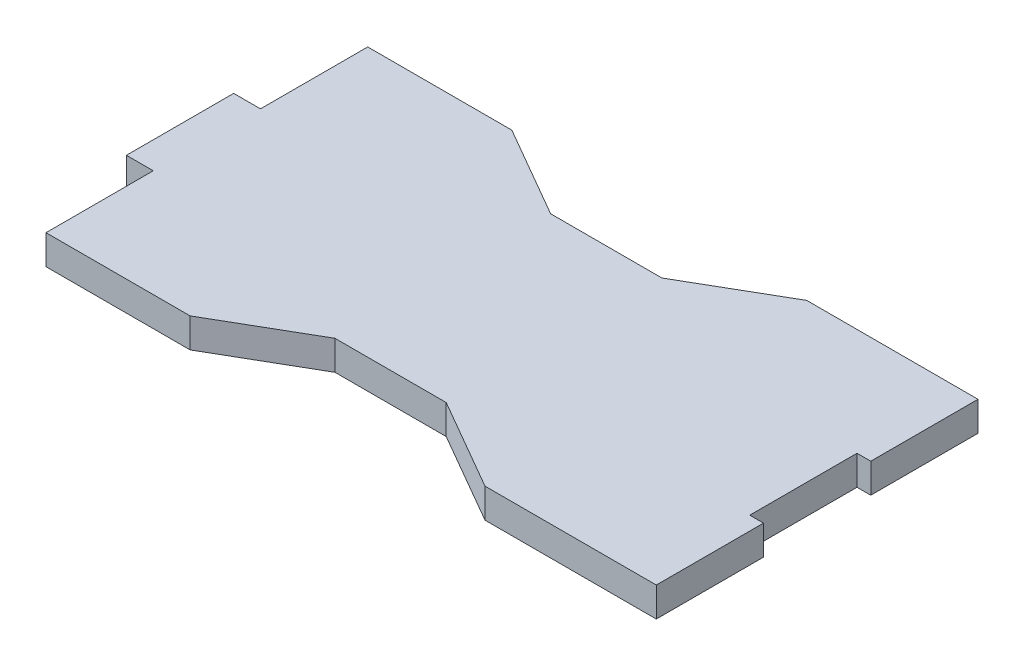
from build123d import *

# Parameters (mm, degrees)
BOSS_EXTRUDE1_DEPTH = 2.2


with BuildPart() as part:
    # Sketch1 → Boss-Extrude1 (new body)
    with BuildSketch(Plane(origin=(0, 0, 0), x_dir=(1, 0, 0), z_dir=(0, 1, 0))):
        Polygon((-90.741972645, 3.865904239), (-90.741972645, 11.865904239), (-103.518191523, 11.865904239), (-110.368333427, 7.910972966), (-118.668049619, 7.910972966), (-125.518191523, 11.865904239), (-136.268191523, 11.865904239), (-136.268191523, 3.865904239), (-138.268191523, 3.865904239), (-138.268191523, -4.134095761), (-136.268191523, -4.134095761), (-136.268191523, -12.134095761), (-125.518191523, -12.134095761), (-118.668049619, -8.179164489), (-110.368333427, -8.179164489), (-103.518191523, -12.134095761), (-90.741972645, -12.134095761), (-90.741972645, -4.134095761), (-91.768191523, -4.134095761), (-91.768191523, 3.865904239), align=None)
    extrude(amount=BOSS_EXTRUDE1_DEPTH)


solid = part.part
